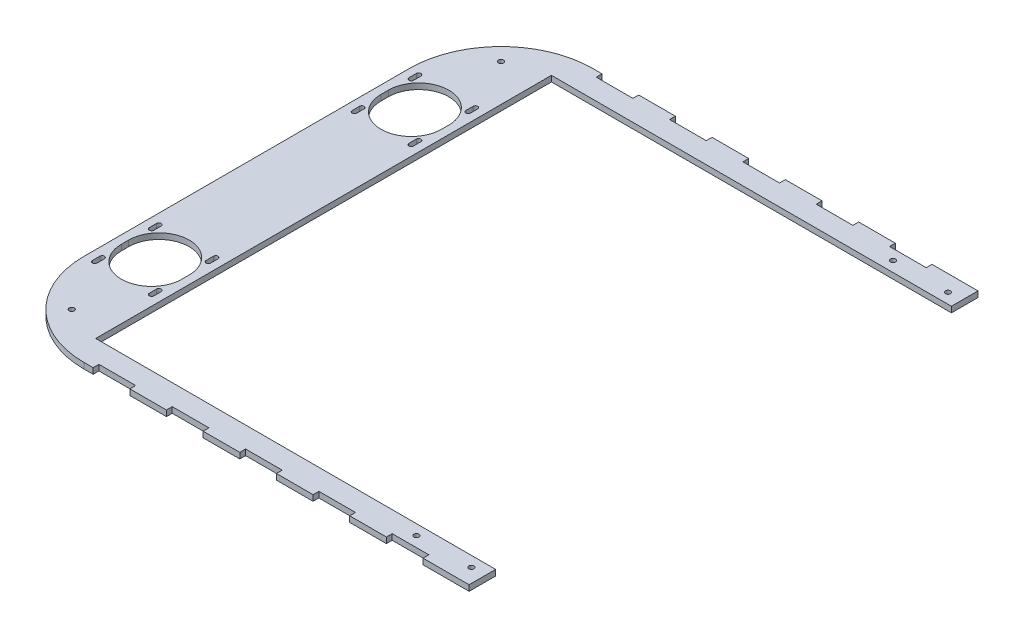
from build123d import *

# Parameters (mm, degrees)
SKETCH1_R           = 1.25
SKETCH1_R_2         = 16.5
BOSS_EXTRUDE1_DEPTH = 3.15
SKETCH2_W           = 42
SKETCH2_H           = 34
BOSS_EXTRUDE2_DEPTH = 3.15
FILLET1_R           = 50
SKETCH3_W           = 20
SKETCH3_H           = 3.16
CUT_EXTRUDE1_DEPTH  = 255.013877696
SKETCH4_R           = 1.4
CUT_EXTRUDE2_DEPTH  = 10
SKETCH5_R           = 1.4
CUT_EXTRUDE3_DEPTH  = 10
CUT_EXTRUDE4_DEPTH  = 255.013877696
SKETCH8_W           = 218.2
SKETCH8_H           = 1.5
BOSS_EXTRUDE3_DEPTH = 3.15


with BuildPart() as part:
    # Sketch1 → Boss-Extrude1 (new body)
    with BuildSketch(Plane(origin=(0, 11.030201327, 0), x_dir=(1, 0, 0), z_dir=(0, 1, 0))):
        Polygon((-162.156726515, -108.167379901), (-194.899872265, -108.167379901), (-199.52829939, -108.167379901), (-199.52829939, 34.111047224), (-199.52829939, 66.854192974), (-199.52829939, 71.482620099), (-194.899872265, 71.482620099), (-162.156726515, 71.482620099), (-157.52829939, 71.482620099), (-157.52829939, -108.167379901), align=None)
        with Locations(Location((-163.02829939, 65.982620099, 0), (0, 0, 270))):
            Circle(SKETCH1_R, mode=Mode.SUBTRACT)
        with Locations(Location((-163.02829939, 34.982620099, 0), (0, 0, 270))):
            Circle(SKETCH1_R, mode=Mode.SUBTRACT)
        with Locations(Location((-194.02829939, 34.982620099, 0), (0, 0, 270))):
            Circle(SKETCH1_R, mode=Mode.SUBTRACT)
        with Locations(Location((-194.02829939, 65.982620099, 0), (0, 0, 270))):
            Circle(SKETCH1_R, mode=Mode.SUBTRACT)
        with Locations(Location((-163.02829939, -102.667379901, 0), (0, 0, 270))):
            Circle(SKETCH1_R, mode=Mode.SUBTRACT)
        with Locations(Location((-163.02829939, -71.667379901, 0), (0, 0, 270))):
            Circle(SKETCH1_R, mode=Mode.SUBTRACT)
        with Locations(Location((-194.02829939, -102.667379901, 0), (0, 0, 270))):
            Circle(SKETCH1_R, mode=Mode.SUBTRACT)
        with Locations(Location((-194.02829939, -71.667379901, 0), (0, 0, 270))):
            Circle(SKETCH1_R, mode=Mode.SUBTRACT)
        with Locations(Location((-178.52829939, -87.167379901, 0), (0, 0, 270))):
            Circle(SKETCH1_R_2, mode=Mode.SUBTRACT)
        with Locations(Location((-178.52829939, 50.482620099, 0), (0, 0, 270))):
            Circle(SKETCH1_R_2, mode=Mode.SUBTRACT)
    extrude(amount=BOSS_EXTRUDE1_DEPTH)

    # Sketch2 → Boss-Extrude2 (add)
    with BuildSketch(Plane(origin=(0, 14.180201327, 0), x_dir=(1, 0, 0), z_dir=(0, 1, 0))):
        Polygon((-157.52829939, -144.167379901), (-157.52829939, -142.167379901), (-157.52829939, -108.167379901), (-199.52829939, -108.167379901), (-199.52829939, -142.167379901), (-199.52829939, -157.167379901), (-157.52829939, -157.167379901), (60.67170061, -157.167379901), (60.67170061, -144.167379901), (45.67170061, -144.167379901), align=None)
        with Locations((-178.52829939, 88.482620099)):
            Rectangle(SKETCH2_W, SKETCH2_H)
        Polygon((-199.52829939, 105.482620099), (-157.52829939, 105.482620099), (-157.52829939, 107.482620099), (45.67170061, 107.482620099), (60.67170061, 107.482620099), (60.67170061, 120.482620099), (-157.52829939, 120.482620099), (-199.52829939, 120.482620099), align=None)
    extrude(amount=-BOSS_EXTRUDE2_DEPTH)

    # Fillet1
    fillet1_edges = [part.edges().sort_by_distance(p)[0] for p in [
        (-199.52829939, 12.605201327, 157.167379901),
        (-199.52829939, 12.605201327, -120.482620099),
    ]]
    fillet(fillet1_edges, radius=FILLET1_R)

    # Sketch3 → Cut-Extrude1 (cut, through all)
    with BuildSketch(Plane(origin=(0, 14.180201327, 0), x_dir=(1, 0, 0), z_dir=(0, 1, 0))):
        with Locations((-94.42829939, 118.902620099)):
            Rectangle(SKETCH3_W, SKETCH3_H)
        with Locations((-134.42829939, 118.902620099)):
            Rectangle(SKETCH3_W, SKETCH3_H)
        with Locations((-54.42829939, 118.902620099)):
            Rectangle(SKETCH3_W, SKETCH3_H)
        with Locations((-14.42829939, 118.902620099)):
            Rectangle(SKETCH3_W, SKETCH3_H)
        with Locations((25.57170061, 118.902620099)):
            Rectangle(SKETCH3_W, SKETCH3_H)
        with Locations((25.57170061, -155.587379901)):
            Rectangle(SKETCH3_W, SKETCH3_H)
        with Locations((-14.42829939, -155.587379901)):
            Rectangle(SKETCH3_W, SKETCH3_H)
        with Locations((-54.42829939, -155.587379901)):
            Rectangle(SKETCH3_W, SKETCH3_H)
        with Locations((-94.42829939, -155.587379901)):
            Rectangle(SKETCH3_W, SKETCH3_H)
        with Locations((-134.42829939, -155.587379901)):
            Rectangle(SKETCH3_W, SKETCH3_H)
    extrude(amount=-CUT_EXTRUDE1_DEPTH, mode=Mode.SUBTRACT)

    # Sketch4 → Cut-Extrude2 (cut)
    with BuildSketch(Plane(origin=(0, 14.180201327, 0), x_dir=(1, 0, 0), z_dir=(0, 1, 0))):
        with Locations(Location((-177.812570637, 98.766891346, 0), (0, 0, 270))):
            Circle(SKETCH4_R)
        with Locations(Location((-177.812570637, -135.451651148, 0), (0, 0, 270))):
            Circle(SKETCH4_R)
    extrude(amount=-CUT_EXTRUDE2_DEPTH, mode=Mode.SUBTRACT)

    # Sketch5 → Cut-Extrude3 (cut)
    with BuildSketch(Plane(origin=(0, 14.180201327, 0), x_dir=(1, 0, 0), z_dir=(0, 1, 0))):
        with Locations(Location((53.12170061, 111.647620099, 0), (0, 0, 270))):
            Circle(SKETCH5_R)
        with Locations(Location((53.12170061, -148.342379901, 0), (0, 0, 270))):
            Circle(SKETCH5_R)
        with Locations(Location((23.12170061, 111.647620099, 0), (0, 0, 270))):
            Circle(SKETCH5_R)
        with Locations(Location((23.12170061, -148.342379901, 0), (0, 0, 270))):
            Circle(SKETCH5_R)
    extrude(amount=-CUT_EXTRUDE3_DEPTH, mode=Mode.SUBTRACT)

    # Sketch6 → Cut-Extrude4 (cut, through all)
    with BuildSketch(Plane(origin=(0, 14.180201327, 0), x_dir=(1, 0, 0), z_dir=(0, 1, 0))):
        with BuildLine():
            Line((-161.77829939, 69.982620099), (-161.77829939, 65.982620099))
            ThreePointArc((-161.77829939, 65.982620099), (-163.02829939, 64.732620099), (-164.27829939, 65.982620099))
            Line((-164.27829939, 65.982620099), (-164.27829939, 69.982620099))
            ThreePointArc((-164.27829939, 69.982620099), (-163.02829939, 71.232620099), (-161.77829939, 69.982620099))
        make_face()
        with BuildLine():
            Line((-161.77829939, 38.982620099), (-161.77829939, 34.982620099))
            ThreePointArc((-161.77829939, 34.982620099), (-163.02829939, 33.732620099), (-164.27829939, 34.982620099))
            Line((-164.27829939, 34.982620099), (-164.27829939, 38.982620099))
            ThreePointArc((-164.27829939, 38.982620099), (-163.02829939, 40.232620099), (-161.77829939, 38.982620099))
        make_face()
        with BuildLine():
            Line((-192.77829939, 38.982620099), (-192.77829939, 34.982620099))
            ThreePointArc((-192.77829939, 34.982620099), (-194.02829939, 33.732620099), (-195.27829939, 34.982620099))
            Line((-195.27829939, 34.982620099), (-195.27829939, 38.982620099))
            ThreePointArc((-195.27829939, 38.982620099), (-194.02829939, 40.232620099), (-192.77829939, 38.982620099))
        make_face()
        with BuildLine():
            Line((-195.27829939, 69.982620099), (-195.27829939, 65.982620099))
            ThreePointArc((-195.27829939, 65.982620099), (-194.02829939, 64.732620099), (-192.77829939, 65.982620099))
            Line((-192.77829939, 65.982620099), (-192.77829939, 69.982620099))
            ThreePointArc((-192.77829939, 69.982620099), (-194.02829939, 71.232620099), (-195.27829939, 69.982620099))
        make_face()
        with BuildLine():
            Line((-162.02829939, 54.482620099), (-162.02829939, 50.482620099))
            ThreePointArc((-162.02829939, 50.482620099), (-178.52829939, 33.982620099), (-195.02829939, 50.482620099))
            Line((-195.02829939, 50.482620099), (-195.02829939, 54.482620099))
            ThreePointArc((-195.02829939, 54.482620099), (-178.52829939, 70.982620099), (-162.02829939, 54.482620099))
        make_face()
        with BuildLine():
            Line((-195.02829939, -91.167379901), (-195.02829939, -87.167379901))
            ThreePointArc((-195.02829939, -87.167379901), (-178.52829939, -70.667379901), (-162.02829939, -87.167379901))
            Line((-162.02829939, -87.167379901), (-162.02829939, -91.167379901))
            ThreePointArc((-162.02829939, -91.167379901), (-178.52829939, -107.667379901), (-195.02829939, -91.167379901))
        make_face()
        with BuildLine():
            Line((-192.77829939, -106.667379901), (-192.77829939, -102.667379901))
            ThreePointArc((-192.77829939, -102.667379901), (-194.02829939, -101.417379901), (-195.27829939, -102.667379901))
            Line((-195.27829939, -102.667379901), (-195.27829939, -106.667379901))
            ThreePointArc((-195.27829939, -106.667379901), (-194.02829939, -107.917379901), (-192.77829939, -106.667379901))
        make_face()
        with BuildLine():
            Line((-195.27829939, -71.667379901), (-195.27829939, -75.667379901))
            ThreePointArc((-195.27829939, -75.667379901), (-194.02829939, -76.917379901), (-192.77829939, -75.667379901))
            Line((-192.77829939, -75.667379901), (-192.77829939, -71.667379901))
            ThreePointArc((-192.77829939, -71.667379901), (-194.02829939, -70.417379901), (-195.27829939, -71.667379901))
        make_face()
        with BuildLine():
            Line((-164.27829939, -71.667379901), (-164.27829939, -75.667379901))
            ThreePointArc((-164.27829939, -75.667379901), (-163.02829939, -76.917379901), (-161.77829939, -75.667379901))
            Line((-161.77829939, -75.667379901), (-161.77829939, -71.667379901))
            ThreePointArc((-161.77829939, -71.667379901), (-163.02829939, -70.417379901), (-164.27829939, -71.667379901))
        make_face()
        with BuildLine():
            Line((-164.27829939, -102.667379901), (-164.27829939, -106.667379901))
            ThreePointArc((-164.27829939, -106.667379901), (-163.02829939, -107.917379901), (-161.77829939, -106.667379901))
            Line((-161.77829939, -106.667379901), (-161.77829939, -102.667379901))
            ThreePointArc((-161.77829939, -102.667379901), (-163.02829939, -101.417379901), (-164.27829939, -102.667379901))
        make_face()
    extrude(amount=-CUT_EXTRUDE4_DEPTH, mode=Mode.SUBTRACT)

    # Sketch8 → Boss-Extrude3 (add)
    with BuildSketch(Plane(origin=(0, 14.180201327, 0), x_dir=(1, 0, 0), z_dir=(0, 1, 0))):
        with Locations((-48.42829939, -143.417379901)):
            Rectangle(SKETCH8_W, SKETCH8_H)
        with Locations((-48.42829939, 106.732620099)):
            Rectangle(SKETCH8_W, SKETCH8_H)
    extrude(amount=-BOSS_EXTRUDE3_DEPTH)


solid = part.part
